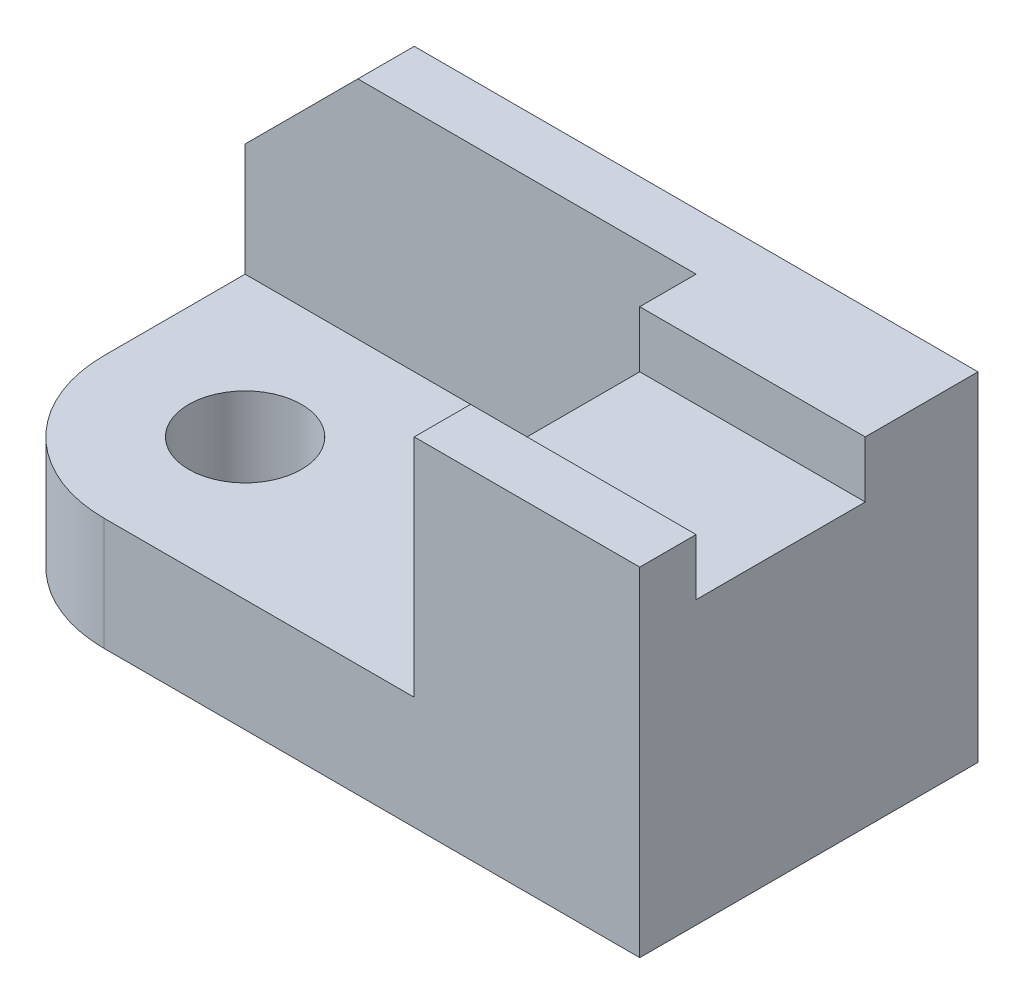
from build123d import *

# Parameters (mm, degrees)
SKETCH1_W           = 120
SKETCH1_H           = 60
BOSS_EXTRUDE1_DEPTH = 20
SKETCH2_W           = 120
SKETCH2_H           = 10
BOSS_EXTRUDE2_DEPTH = 40
CHAMFER1_SIZE       = 20
FILLET1_R           = 25
SKETCH4_W           = 40
SKETCH4_H           = 50
BOSS_EXTRUDE5_DEPTH = 40
SKETCH5_W           = 40
SKETCH5_H           = 30
CUT_EXTRUDE1_DEPTH  = 10
SKETCH6_R           = 10
CUT_EXTRUDE2_DEPTH  = 79.102496759


with BuildPart() as part:
    # Sketch1 → Boss-Extrude1 (new body)
    with BuildSketch(Plane(origin=(0, 0, 0), x_dir=(1, 0, 0), z_dir=(0, 1, 0))):
        Rectangle(SKETCH1_W, SKETCH1_H)
    extrude(amount=BOSS_EXTRUDE1_DEPTH)

    # Sketch2 → Boss-Extrude2 (add)
    with BuildSketch(Plane(origin=(0, 20, 0), x_dir=(1, 0, 0), z_dir=(0, 1, 0))):
        with Locations((0, 25)):
            Rectangle(SKETCH2_W, SKETCH2_H)
    extrude(amount=BOSS_EXTRUDE2_DEPTH)

    # Chamfer1
    chamfer1_edges = [part.edges().sort_by_distance(p)[0] for p in [
        (-60, 60, -25),
    ]]
    chamfer(chamfer1_edges, length=CHAMFER1_SIZE)

    # Fillet1
    fillet1_edges = [part.edges().sort_by_distance(p)[0] for p in [
        (-60, 10, 30),
    ]]
    fillet(fillet1_edges, radius=FILLET1_R)

    # Sketch4 → Boss-Extrude5 (add)
    with BuildSketch(Plane(origin=(0, 20, 0), x_dir=(1, 0, 0), z_dir=(0, 1, 0))):
        with Locations((40, -5)):
            Rectangle(SKETCH4_W, SKETCH4_H)
    extrude(amount=BOSS_EXTRUDE5_DEPTH)

    # Sketch5 → Cut-Extrude1 (cut)
    with BuildSketch(Plane(origin=(0, 60, 0), x_dir=(1, 0, 0), z_dir=(0, 1, 0))):
        with Locations((40, -5)):
            Rectangle(SKETCH5_W, SKETCH5_H)
    extrude(amount=-CUT_EXTRUDE1_DEPTH, mode=Mode.SUBTRACT)

    # Sketch6 → Cut-Extrude2 (cut, through all)
    with BuildSketch(Plane(origin=(0, 20, 0), x_dir=(1, 0, 0), z_dir=(0, 1, 0))):
        with Locations(Location((-35, -5, 0), (0, 0, 270))):
            Circle(SKETCH6_R)
    extrude(amount=-CUT_EXTRUDE2_DEPTH, mode=Mode.SUBTRACT)


solid = part.part
